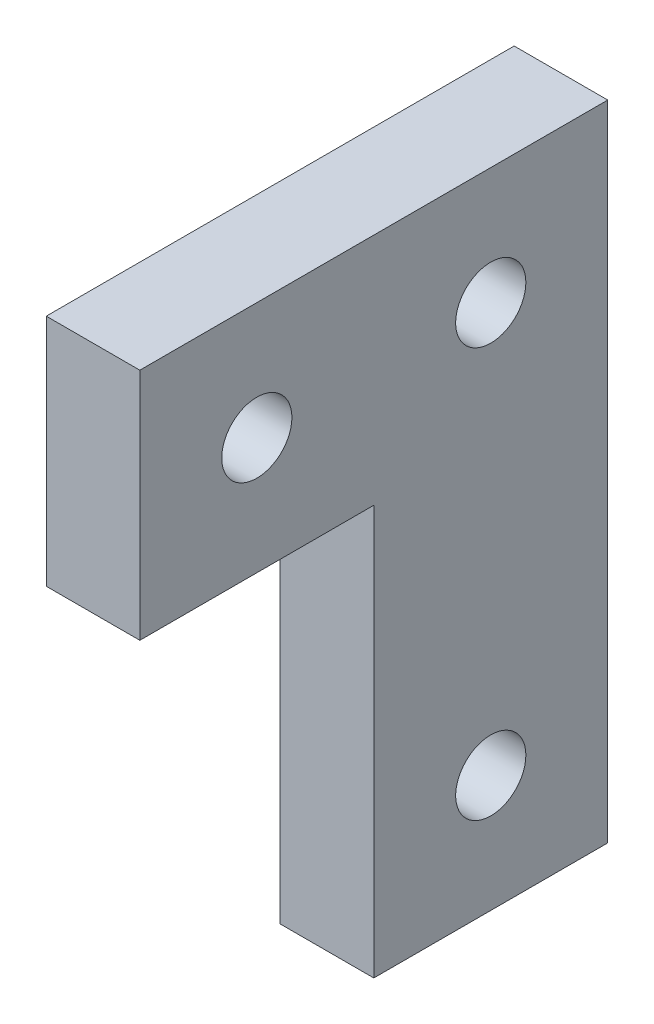
from build123d import *

# Parameters (mm, degrees)
SKETCH_1_R      = 0.6
EXTRUDE_1_DEPTH = 1.6


with BuildPart() as part:
    # 草图1 → 凸台-拉伸1 (new body)
    with BuildSketch(Plane(origin=(0, 0, 0), x_dir=(0, 0, -1), z_dir=(1, 0, 0))):
        Polygon((-6, 2), (-6, -2), (-2, -2), (-2, -9), (2, -9), (2, 2), align=None)
        with Locations((0, -7)):
            Circle(SKETCH_1_R, mode=Mode.SUBTRACT)
        with Locations((-4, 0)):
            Circle(SKETCH_1_R, mode=Mode.SUBTRACT)
        Circle(SKETCH_1_R, mode=Mode.SUBTRACT)
    extrude(amount=EXTRUDE_1_DEPTH)


solid = part.part
